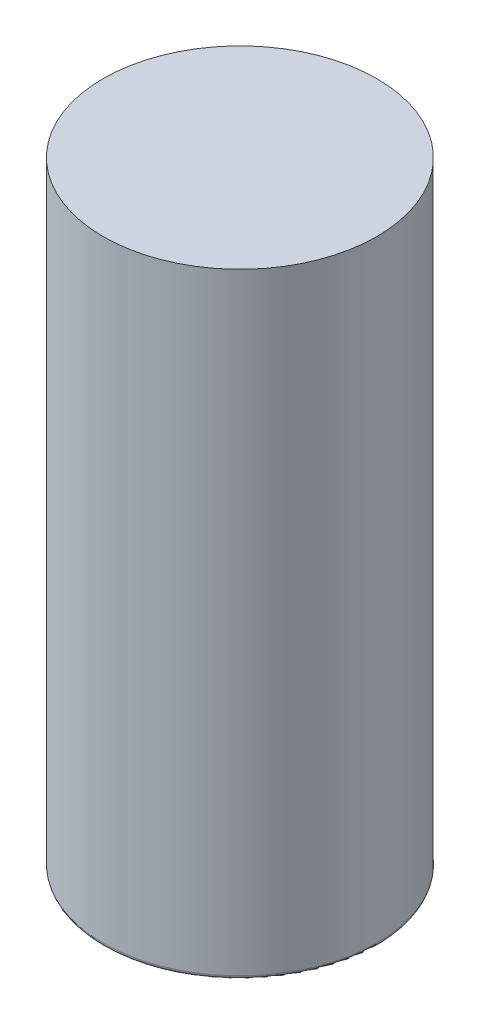
from build123d import *

# Parameters (mm, degrees)
SKETCH1_R           = 9
BOSS_EXTRUDE1_DEPTH = 40.5
FILLET1_R           = 0.254


with BuildPart() as part:
    # Sketch1 → Boss-Extrude1 (new body)
    with BuildSketch(Plane(origin=(0, 0, 0), x_dir=(1, 0, 0), z_dir=(0, 1, 0))):
        with Locations(Location((0, 0, 0), (0, 0, 270))):
            Circle(SKETCH1_R)
    extrude(amount=BOSS_EXTRUDE1_DEPTH)

    # Fillet1
    fillet1_edges = [part.edges().sort_by_distance(p)[0] for p in [
        (0, 0, -9),
    ]]
    fillet(fillet1_edges, radius=FILLET1_R)


solid = part.part
